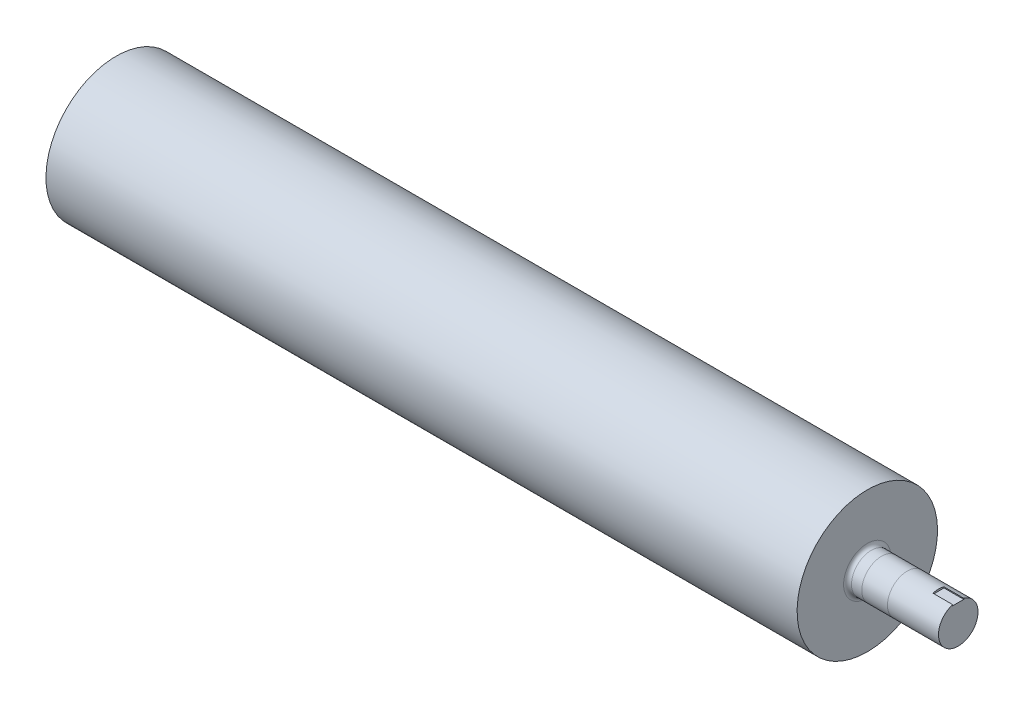
from build123d import *

# Parameters (mm, degrees)
FILLET1_R          = 10
CUT_EXTRUDE1_START = -50
CUT_EXTRUDE1_DEPTH = 50


with BuildPart() as part:
    # Sketch1 → Revolve1 (revolve)
    with BuildSketch(Plane.XY, mode=Mode.PRIVATE) as revolve1_sk:
        Polygon((-1040, 0), (1180, 0), (1180, 50), (950, 50), (950, 177.595701724), (0, 177.595701724), (-950, 177.595701724), (-950, 50), (-1040, 50), align=None)
    revolve(revolve1_sk.sketch.rotate(Axis((-1040, 0, 0), (1, 0, 0)), 180), axis=Axis((-1040, 0, 0), (1, 0, 0)))

    # Fillet1
    fillet1_edges = [part.edges().sort_by_distance(p)[0] for p in [
        (950, 50, 0),
        (-950, 50, 0),
    ]]
    fillet(fillet1_edges, radius=FILLET1_R)

    # Sketch2 → Cut-Extrude1 (cut)
    with BuildSketch(Plane(origin=(1180, 0, 0), x_dir=(0, 0, -1), z_dir=(1, 0, 0)).offset(CUT_EXTRUDE1_START)):
        with BuildLine():
            ThreePointArc((14, 48), (0, 50), (-14, 48))
            Line((-14, 48), (-14, 45.4))
            Line((-14, 45.4), (14, 45.4))
            Line((14, 45.4), (14, 48))
        make_face()
    extrude(amount=CUT_EXTRUDE1_DEPTH, mode=Mode.SUBTRACT)


solid = part.part
